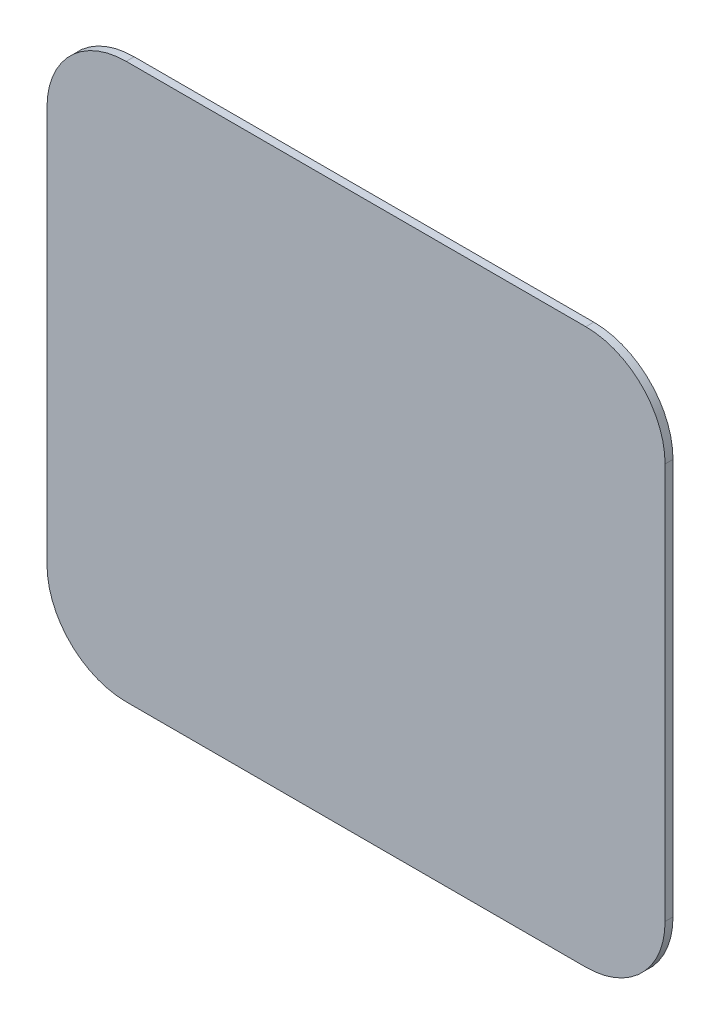
from build123d import *

# Parameters (mm, degrees)
SKETCH1_W           = 78
SKETCH1_H           = 70
BOSS_EXTRUDE1_DEPTH = 1
FILLET1_R           = 10


with BuildPart() as part:
    # Sketch1 → Boss-Extrude1 (new body)
    with BuildSketch(Plane.XY):
        with Locations((-0.075399098, 4.950190099)):
            Rectangle(SKETCH1_W, SKETCH1_H)
    extrude(amount=BOSS_EXTRUDE1_DEPTH)

    # Fillet1
    fillet1_edges = [part.edges().sort_by_distance(p)[0] for p in [
        (38.924600902, -30.049809901, 0.5),
        (-39.075399098, -30.049809901, 0.5),
        (-39.075399098, 39.950190099, 0.5),
        (38.924600902, 39.950190099, 0.5),
    ]]
    fillet(fillet1_edges, radius=FILLET1_R)


solid = part.part
